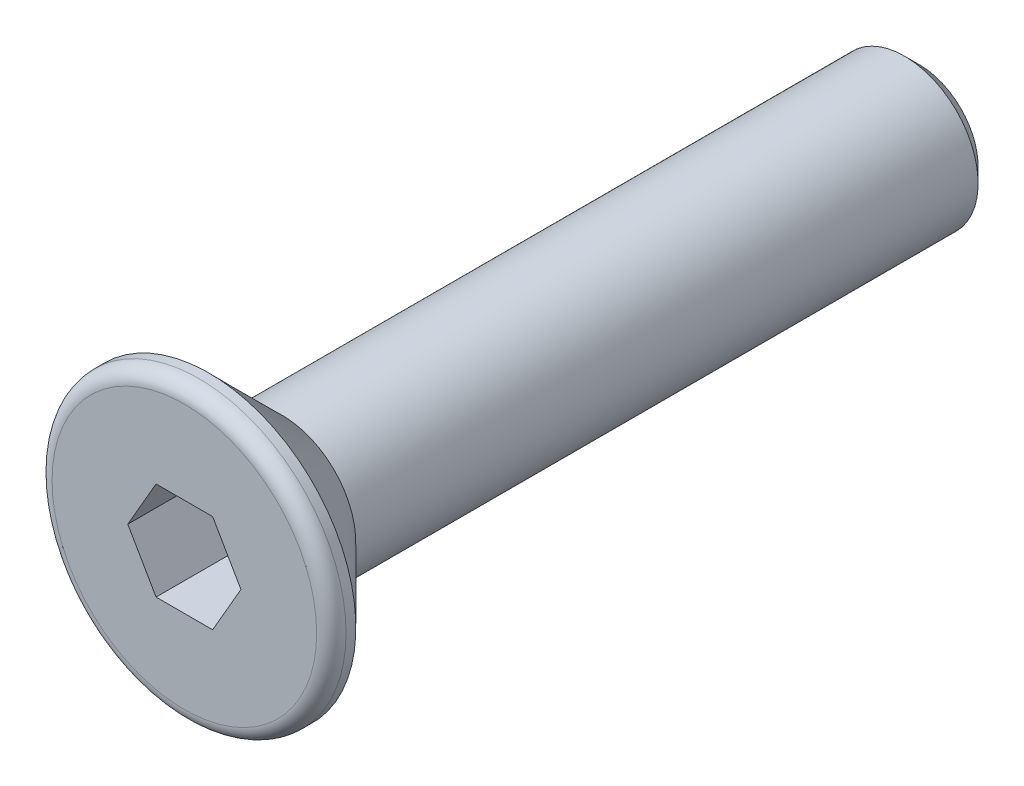
from build123d import *

# Parameters (mm, degrees)
CUT_EXTRUDE_1_DEPTH = 1.5
FILLET_1_R          = 0.3


with BuildPart() as part:
    # 草图1 → 旋转1 (revolve)
    with BuildSketch(Plane(origin=(0, 0, 0), x_dir=(0, 0, -1), z_dir=(1, 0, 0)), mode=Mode.PRIVATE) as revolve_1_sk:
        Polygon((-7.5, 0), (-7.5, 3), (-7, 3), (-5.5, 1.5), (7.2, 1.5), (7.5, 1.2), (7.5, 0), align=None)
    revolve(revolve_1_sk.sketch.rotate(Axis((0, 0, -7.5), (0, 0, 1)), 90), axis=Axis((0, 0, -7.5), (0, 0, 1)))

    # 草图2 → 切除-拉伸1 (cut)
    with BuildSketch(Plane.XY.offset(7.5)):
        Polygon((1.154700538, 0), (0.577350269, 1), (-0.577350269, 1), (-1.154700538, 0), (-0.577350269, -1), (0.577350269, -1), align=None)
    extrude(amount=-CUT_EXTRUDE_1_DEPTH, mode=Mode.SUBTRACT)

    # 圆角1
    fillet_1_edges = [part.edges().sort_by_distance(p)[0] for p in [
        (3, 0, 7.5),
    ]]
    fillet(fillet_1_edges, radius=FILLET_1_R)


solid = part.part
